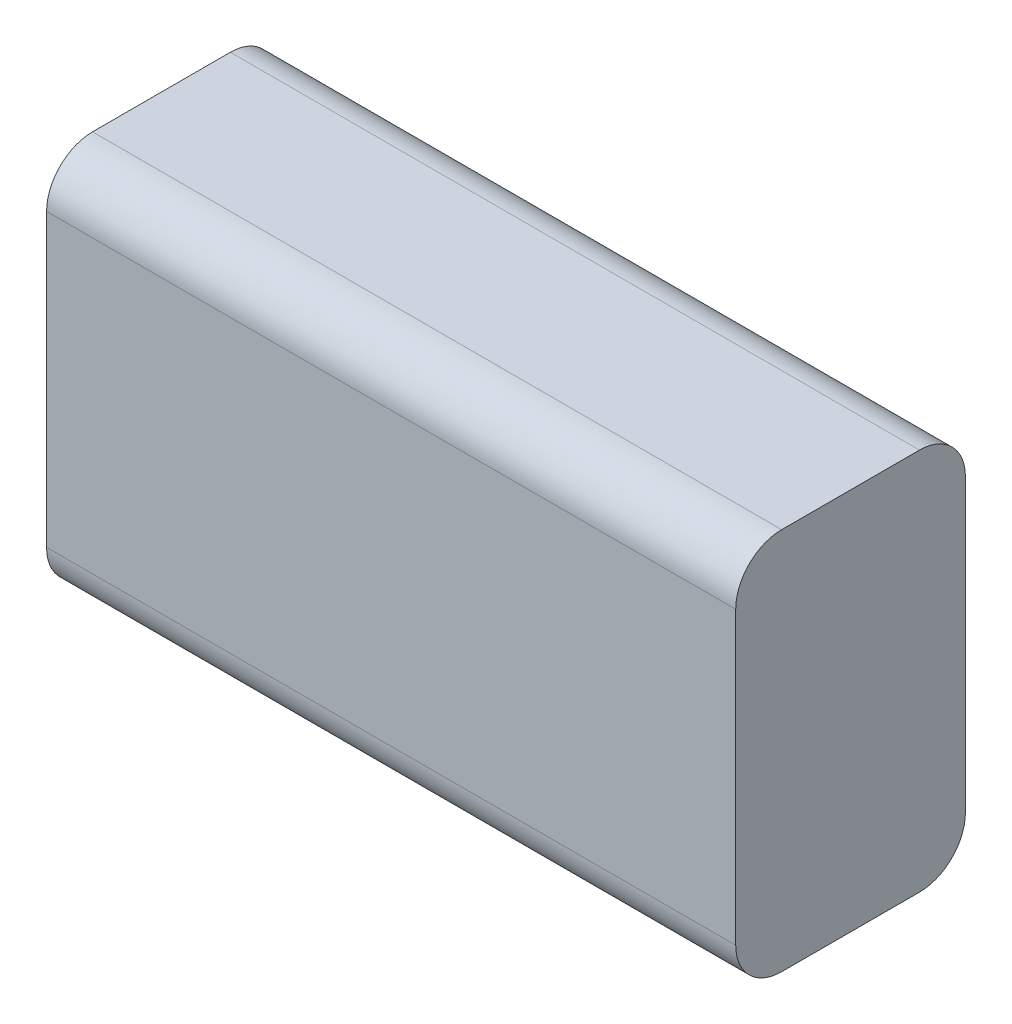
from build123d import *

# Parameters (mm, degrees)
ESBO_O1_W                = 45
ESBO_O1_H                = 25
RESSALTO_EXTRUS_O1_DEPTH = 15
FILETE1_R                = 3


with BuildPart() as part:
    # Esboço1 → Ressalto-extrusão1 (new body)
    with BuildSketch(Plane.XY):
        with Locations((22.5, 12.5)):
            Rectangle(ESBO_O1_W, ESBO_O1_H)
    extrude(amount=RESSALTO_EXTRUS_O1_DEPTH)

    # Filete1
    filete1_edges = [part.edges().sort_by_distance(p)[0] for p in [
        (22.5, 25, 15),
        (22.5, 25, 0),
        (22.5, 0, 0),
        (22.5, 0, 15),
    ]]
    fillet(filete1_edges, radius=FILETE1_R)


solid = part.part
